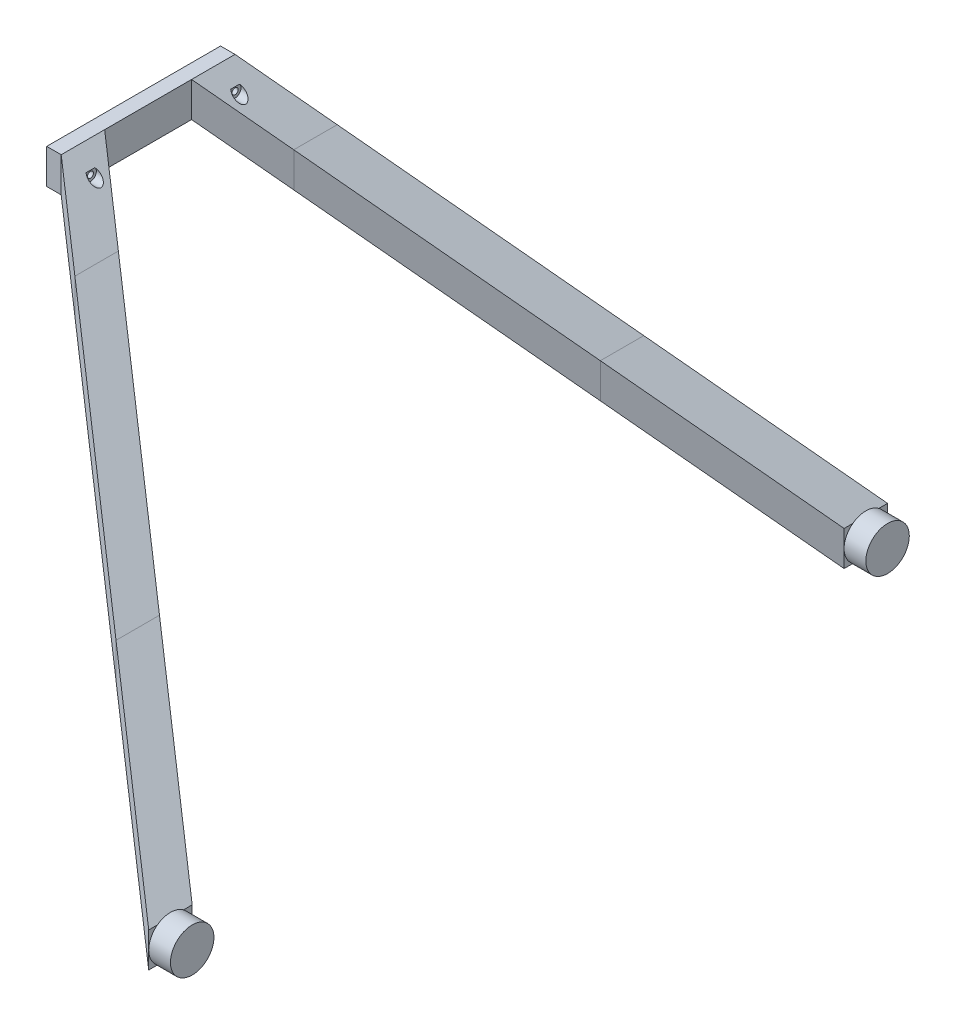
from build123d import *

# Parameters (mm, degrees)
SKETCH2_W           = 24
SKETCH2_H           = 119.99962
SKETCH2_R           = 2.081646704
SKETCH2_R_2         = 2.082179954
BOSS_EXTRUDE1_DEPTH = 10
BOSS_EXTRUDE2_DEPTH = 24.00000022
SKETCH8_R           = 15
BOSS_EXTRUDE3_DEPTH = 15
SKETCH9_R           = 2.082179954
SKETCH9_R_2         = 2.081646704
CUT_EXTRUDE1_DEPTH  = 551.185267113
CUT_EXTRUDE2_START  = 10
SKETCH10_R          = 4.082179954
SKETCH10_R_2        = 4.081646704
CUT_EXTRUDE2_DEPTH  = 541.185267113
SKETCH11_W          = 24
SKETCH11_H          = 18
CUT_EXTRUDE3_DEPTH  = 30
SKETCH12_W          = 24
SKETCH12_H          = 18
CUT_EXTRUDE4_DEPTH  = 30
SKETCH13_W          = 24
SKETCH13_H          = 18
CUT_EXTRUDE5_DEPTH  = 30
SKETCH14_W          = 24
SKETCH14_H          = 18
CUT_EXTRUDE6_DEPTH  = 30
SKETCH15_W          = 23.6
SKETCH15_H          = 17.6
BOSS_EXTRUDE4_DEPTH = 30
SKETCH16_W          = 23.6
SKETCH16_H          = 17.6
BOSS_EXTRUDE5_DEPTH = 30
SKETCH17_W          = 23.6
SKETCH17_H          = 17.6
BOSS_EXTRUDE6_DEPTH = 30
SKETCH18_W          = 23.6
SKETCH18_H          = 17.6
BOSS_EXTRUDE7_DEPTH = 30


with BuildPart() as part:
    # Sketch2 → Boss-Extrude1 (new body)
    with BuildSketch(Plane.YZ):
        with Locations((-105.588, 62.57619)):
            Rectangle(SKETCH2_W, SKETCH2_H)
        with Locations(Location((-105.653, 112.38, 0), (0, 0, 270))):
            Circle(SKETCH2_R, mode=Mode.SUBTRACT)
        with Locations(Location((-105.655, 12.5418, 0), (0, 0, 270))):
            Circle(SKETCH2_R_2, mode=Mode.SUBTRACT)
    extrude(amount=BOSS_EXTRUDE1_DEPTH)

    # Sketch7 → Boss-Extrude2 (add, along a direction that is not the sketch's normal)
    with BuildSketch(Plane(origin=(-53.99956314, -57.907441866, 0), x_dir=(-0.7313537016191692, 0.6819983600625, 0), z_dir=(-0.6819983600625, -0.7313537016191692, 0))):
        Polygon((-87.508360179, -2.57638), (-436.757448796, 192.42381), (-436.757448796, 162.42381), (-87.508360179, -32.57638), align=None)
        Polygon((-436.757448796, -287.57619), (-436.757448796, -317.57619), (-87.508360179, -122.576), (-87.508360179, -92.576), align=None)
    extrude(amount=-BOSS_EXTRUDE2_DEPTH, dir=(0, -1, 0))

    # Sketch8 → Boss-Extrude3 (add)
    with BuildSketch(Plane.YZ.offset(265.424613747)):
        with Locations(Location((-343.77530569, 302.57619, 0), (0, 0, 270))):
            Circle(SKETCH8_R)
        with Locations(Location((-343.77530569, -177.42381, 0), (0, 0, 270))):
            Circle(SKETCH8_R)
    extrude(amount=BOSS_EXTRUDE3_DEPTH)

    # Sketch9 → Cut-Extrude1 (cut, through all)
    with BuildSketch(Plane.YZ.offset(10)):
        with Locations((-105.655, 12.5418)):
            Circle(SKETCH9_R)
        with Locations((-105.653, 112.38)):
            Circle(SKETCH9_R_2)
    extrude(amount=CUT_EXTRUDE1_DEPTH, mode=Mode.SUBTRACT)

    # Sketch10 → Cut-Extrude2 (cut, through all)
    with BuildSketch(Plane.YZ.offset(10).offset(CUT_EXTRUDE2_START)):
        with Locations((-105.655, 12.5418)):
            Circle(SKETCH10_R)
        with Locations((-105.653, 112.38)):
            Circle(SKETCH10_R_2)
    extrude(amount=CUT_EXTRUDE2_DEPTH, mode=Mode.SUBTRACT)


with BuildPart() as body_2:
    # Split1: the piece on the far side of the plane
    add(part.part)
    split(bisect_by=Plane(origin=(50, 0, 0), x_dir=(0, 0, 1), z_dir=(1, 0, 0)), keep=Keep.BOTTOM)


with BuildPart() as part_1:
    add(part.part)

    # Split1
    split(bisect_by=Plane(origin=(50, 0, 0), x_dir=(0, 0, 1), z_dir=(1, 0, 0)), keep=Keep.TOP)


with BuildPart() as body_3:
    # Split2: the piece on the far side of the plane
    add(part_1.part)
    split(bisect_by=Plane(origin=(170, 0, 0), x_dir=(0, 0, 1), z_dir=(1, 0, 0)), keep=Keep.BOTTOM)

    # Sketch11 → Cut-Extrude3 (cut, along a direction that is not the sketch's normal)
    with BuildSketch(Plane(origin=(50, 0, 0), x_dir=(0, 0, -1), z_dir=(1, 0, 0))):
        with Locations((-138.113415661, -142.888603446)):
            Rectangle(SKETCH11_W, SKETCH11_H)
    extrude(amount=CUT_EXTRUDE3_DEPTH, dir=(0.6385615343683262, -0.5954682642256793, 0.48750047500000016), mode=Mode.SUBTRACT)

    # Sketch12 → Cut-Extrude4 (cut, along a direction that is not the sketch's normal)
    with BuildSketch(Plane(origin=(50, 0, 0), x_dir=(0, 0, -1), z_dir=(1, 0, 0))):
        with Locations((12.961035661, -142.888603446)):
            Rectangle(SKETCH12_W, SKETCH12_H)
    extrude(amount=CUT_EXTRUDE4_DEPTH, dir=(0.6385615343683262, -0.5954682642256797, -0.4875004749999997), mode=Mode.SUBTRACT)


with BuildPart() as part_2:
    add(part_1.part)

    # Split2
    split(bisect_by=Plane(origin=(170, 0, 0), x_dir=(0, 0, 1), z_dir=(1, 0, 0)), keep=Keep.TOP)

    # Sketch13 → Cut-Extrude5 (cut, along a direction that is not the sketch's normal)
    with BuildSketch(Plane(origin=(170, 0, 0), x_dir=(0, 0, -1), z_dir=(1, 0, 0))):
        with Locations((-229.725662643, -254.790413782)):
            Rectangle(SKETCH13_W, SKETCH13_H)
    extrude(amount=CUT_EXTRUDE5_DEPTH, dir=(0.6385615343683262, -0.5954682642256793, 0.48750047500000016), mode=Mode.SUBTRACT)

    # Sketch14 → Cut-Extrude6 (cut, along a direction that is not the sketch's normal)
    with BuildSketch(Plane(origin=(170, 0, 0), x_dir=(0, 0, -1), z_dir=(1, 0, 0))):
        with Locations((104.573282643, -254.790413782)):
            Rectangle(SKETCH14_W, SKETCH14_H)
    extrude(amount=CUT_EXTRUDE6_DEPTH, dir=(0.6385615343683262, -0.5954682642256797, -0.4875004749999997), mode=Mode.SUBTRACT)


with BuildPart() as body_4:
    # Sketch15 → Boss-Extrude4 (new, along a direction that is not the sketch's normal)
    with BuildSketch(Plane(origin=(50, 0, 0), x_dir=(0, 0, -1), z_dir=(1, 0, 0))):
        with Locations((-138.113415661, -142.888603446)):
            Rectangle(SKETCH15_W, SKETCH15_H)
    extrude(amount=BOSS_EXTRUDE4_DEPTH, dir=(0.6385615343683262, -0.5954682642256793, 0.48750047500000016))


with BuildPart() as body_5:
    # Sketch16 → Boss-Extrude5 (new, along a direction that is not the sketch's normal)
    with BuildSketch(Plane(origin=(50, 0, 0), x_dir=(0, 0, -1), z_dir=(1, 0, 0))):
        with Locations((12.961035661, -142.888603446)):
            Rectangle(SKETCH16_W, SKETCH16_H)
    extrude(amount=BOSS_EXTRUDE5_DEPTH, dir=(0.6385615343683262, -0.5954682642256797, -0.4875004749999997))


with BuildPart() as body_2_1:
    add(body_2.part)

    # Combine1: union body 5, body 4
    add(body_5.part)
    add(body_4.part)


with BuildPart() as body_4_2:
    # Sketch17 → Boss-Extrude6 (new, along a direction that is not the sketch's normal)
    with BuildSketch(Plane(origin=(170, 0, 0), x_dir=(0, 0, -1), z_dir=(1, 0, 0))):
        with Locations((-229.725662643, -254.790413782)):
            Rectangle(SKETCH17_W, SKETCH17_H)
    extrude(amount=BOSS_EXTRUDE6_DEPTH, dir=(0.6385615343683262, -0.5954682642256793, 0.48750047500000016))

    # Combine2: union body 3
    add(body_3.part)


with BuildPart() as body_5_2:
    # Sketch18 → Boss-Extrude7 (new, along a direction that is not the sketch's normal)
    with BuildSketch(Plane(origin=(170, 0, 0), x_dir=(0, 0, -1), z_dir=(1, 0, 0))):
        with Locations((104.573282643, -254.790413782)):
            Rectangle(SKETCH18_W, SKETCH18_H)
    extrude(amount=BOSS_EXTRUDE7_DEPTH, dir=(0.6385615343683262, -0.5954682642256797, -0.4875004749999997))

    # Combine3: union body 4 2
    add(body_4_2.part)


solid = Compound([part_2.part, body_2_1.part, body_5_2.part])
